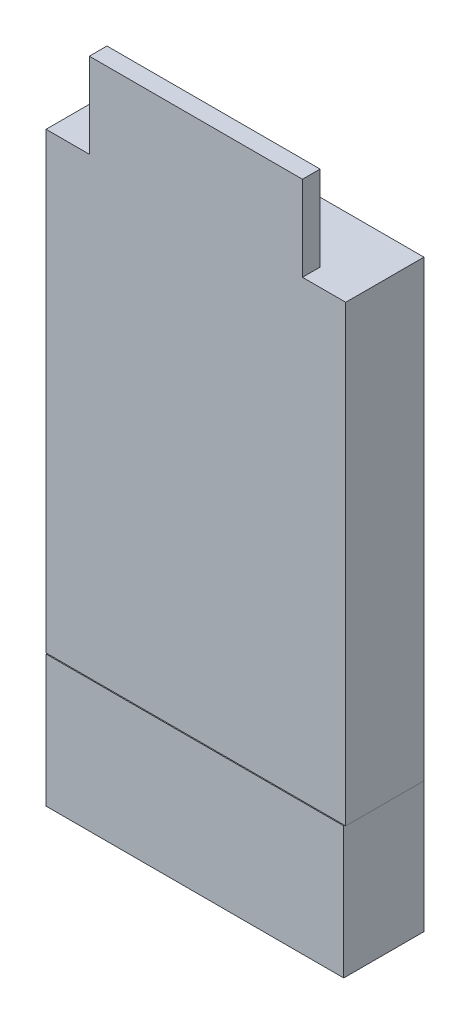
from build123d import *

# Parameters (mm, degrees)
SKICA1_W                = 18.57
SKICA1_H                = 8.22
P_IDAT_VYSUNUT_M1_DEPTH = 5
SKICA2_W                = 18.7
SKICA2_H                = 4.88
P_IDAT_VYSUNUT_M2_DEPTH = 28.3
SKICA3_W                = 13.3
SKICA3_H                = 1.1
P_IDAT_VYSUNUT_M3_DEPTH = 5.3


with BuildPart() as part:
    # Skica1 → Přidat vysunutím1 (new body)
    with BuildSketch(Plane.XY):
        Rectangle(SKICA1_W, SKICA1_H)
    extrude(amount=P_IDAT_VYSUNUT_M1_DEPTH)

    # Skica2 → Přidat vysunutím2 (add)
    with BuildSketch(Plane(origin=(0, 4.11, 0), x_dir=(1, 0, 0), z_dir=(0, 1, 0))):
        with Locations((0, -2.5)):
            Rectangle(SKICA2_W, SKICA2_H)
    extrude(amount=P_IDAT_VYSUNUT_M2_DEPTH)

    # Skica3 → Přidat vysunutím3 (add)
    with BuildSketch(Plane(origin=(0, 32.41, 0), x_dir=(1, 0, 0), z_dir=(0, 1, 0))):
        with Locations((0, -4.39)):
            Rectangle(SKICA3_W, SKICA3_H)
    extrude(amount=P_IDAT_VYSUNUT_M3_DEPTH)


solid = part.part
